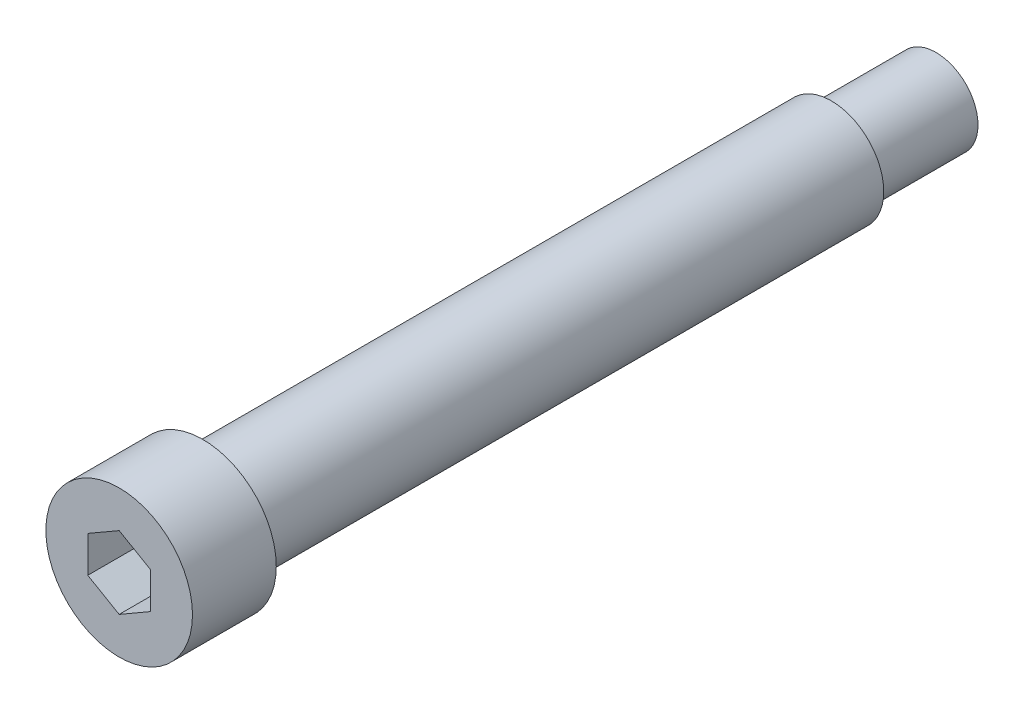
from build123d import *

# Parameters (mm, degrees)
SKETCH_1_R          = 2
EXTRUDE_1_DEPTH     = 5
SKETCH_2_R          = 2.5
EXTRUDE_2_DEPTH     = 30
SKETCH_3_R          = 3.5
EXTRUDE_3_DEPTH     = 4
CUT_EXTRUDE_1_DEPTH = 3


with BuildPart() as part:
    # Эскиз1 → Бобышка-Вытянуть1 (new body)
    with BuildSketch(Plane.XY):
        Circle(SKETCH_1_R)
    extrude(amount=EXTRUDE_1_DEPTH)

    # Эскиз2 → Бобышка-Вытянуть2 (add)
    with BuildSketch(Plane.XY.offset(5)):
        Circle(SKETCH_2_R)
    extrude(amount=EXTRUDE_2_DEPTH)

    # Эскиз3 → Бобышка-Вытянуть3 (add)
    with BuildSketch(Plane.XY.offset(35)):
        Circle(SKETCH_3_R)
    extrude(amount=EXTRUDE_3_DEPTH)

    # Эскиз4 → Вырез-Вытянуть1 (cut)
    with BuildSketch(Plane.XY.offset(39)):
        Polygon((1.5, 0.866025404), (0, 1.732050808), (-1.5, 0.866025404), (-1.5, -0.866025404), (0, -1.732050808), (1.5, -0.866025404), align=None)
    extrude(amount=-CUT_EXTRUDE_1_DEPTH, mode=Mode.SUBTRACT)


solid = part.part
